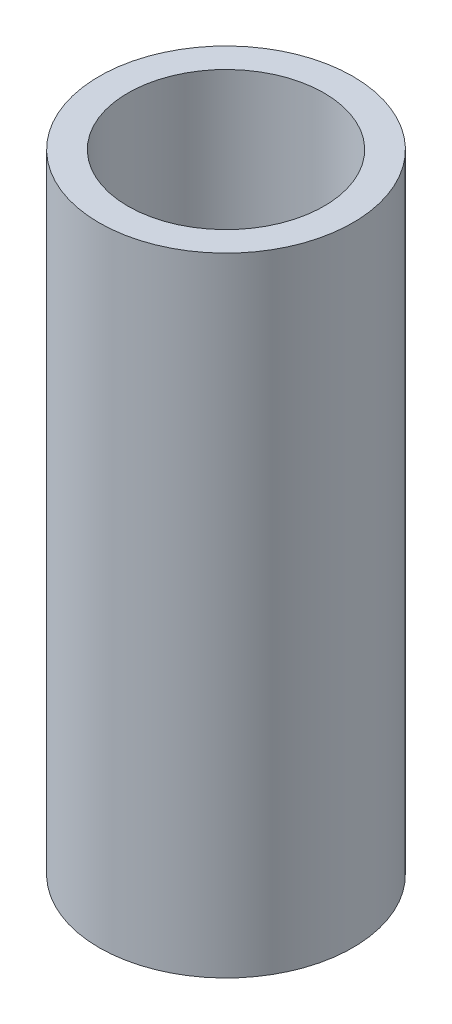
from build123d import *

# Parameters (mm, degrees)
SKETCH2_R           = 2.053379903
SKETCH2_R_2         = 1.5875
BOSS_EXTRUDE1_DEPTH = 10.16


with BuildPart() as part:
    # Sketch2 → Boss-Extrude1 (new body)
    with BuildSketch(Plane(origin=(0, 0, 0), x_dir=(1, 0, 0), z_dir=(0, 1, 0))):
        with Locations(Location((0, 0, 0), (0, 0, 270))):
            Circle(SKETCH2_R)
        with Locations(Location((0, 0, 0), (0, 0, 270))):
            Circle(SKETCH2_R_2, mode=Mode.SUBTRACT)
    extrude(amount=BOSS_EXTRUDE1_DEPTH)


solid = part.part
